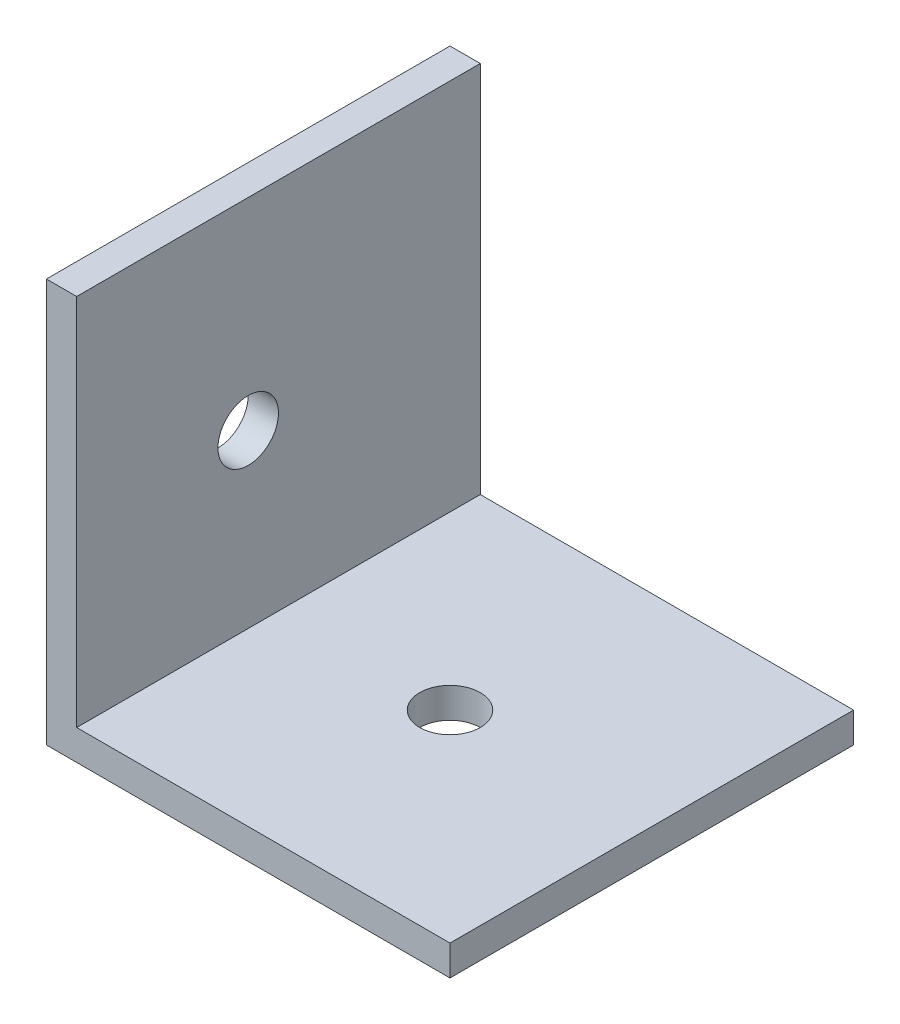
from build123d import *

# Parameters (mm, degrees)
EXTRUSION1_DEPTH = 20
ESQUISSE7_R      = 1.5
EXTRUSION7_DEPTH = 34.797189232
ESQUISSE9_R      = 1.5
EXTRUSION8_DEPTH = 34.797189232


with BuildPart() as part:
    # Esquisse1 → Extrusion1 (new body)
    with BuildSketch(Plane.XY):
        Polygon((0, 0), (20, 0), (20, 1.5), (1.5, 1.5), (1.5, 20), (0, 20), align=None)
    extrude(amount=EXTRUSION1_DEPTH)

    # Esquisse7 → Extrusion7 (cut, through all)
    with BuildSketch(Plane(origin=(0, 1.5, 0), x_dir=(-1, 0, 0), z_dir=(0, 1, 0))):
        with Locations((-10, 10)):
            Circle(ESQUISSE7_R)
    extrude(amount=-EXTRUSION7_DEPTH, mode=Mode.SUBTRACT)

    # Esquisse9 → Extrusion8 (cut, through all)
    with BuildSketch(Plane(origin=(1.5, 0, 0), x_dir=(0, 0, -1), z_dir=(1, 0, 0))):
        with Locations(Location((-11.5, 10, 0), (0, 0, 90))):
            Circle(ESQUISSE9_R)
    extrude(amount=-EXTRUSION8_DEPTH, mode=Mode.SUBTRACT)


solid = part.part
